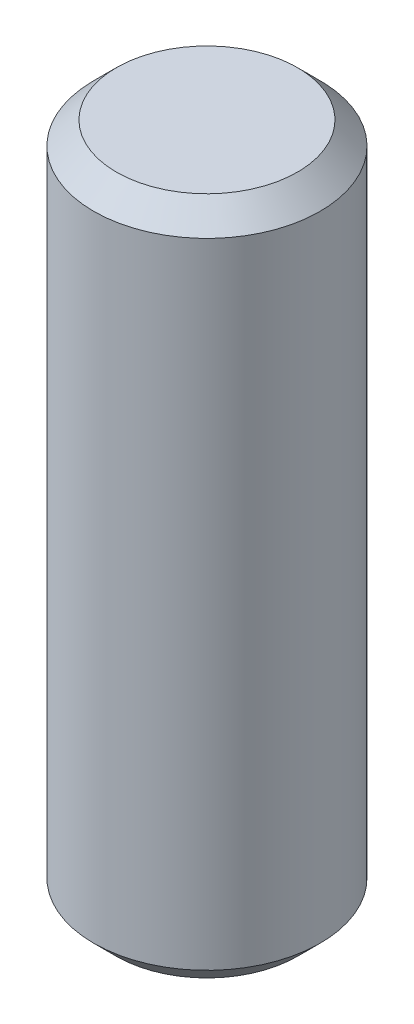
from build123d import *

# Parameters (mm, degrees)
SKETCH2_R           = 0.5
BOSS_EXTRUDE1_DEPTH = 3
CHAMFER1_SIZE       = 0.1


with BuildPart() as part:
    # Sketch2 → Boss-Extrude1 (new body)
    with BuildSketch(Plane(origin=(0, 0, 0), x_dir=(1, 0, 0), z_dir=(0, 1, 0))):
        with Locations(Location((0, 0, 0), (0, 0, 270))):
            Circle(SKETCH2_R)
    extrude(amount=BOSS_EXTRUDE1_DEPTH)

    # Chamfer1
    chamfer1_edges = [part.edges().sort_by_distance(p)[0] for p in [
        (0, 0, -0.5),
        (0, 3, -0.5),
    ]]
    chamfer(chamfer1_edges, length=CHAMFER1_SIZE)


solid = part.part
